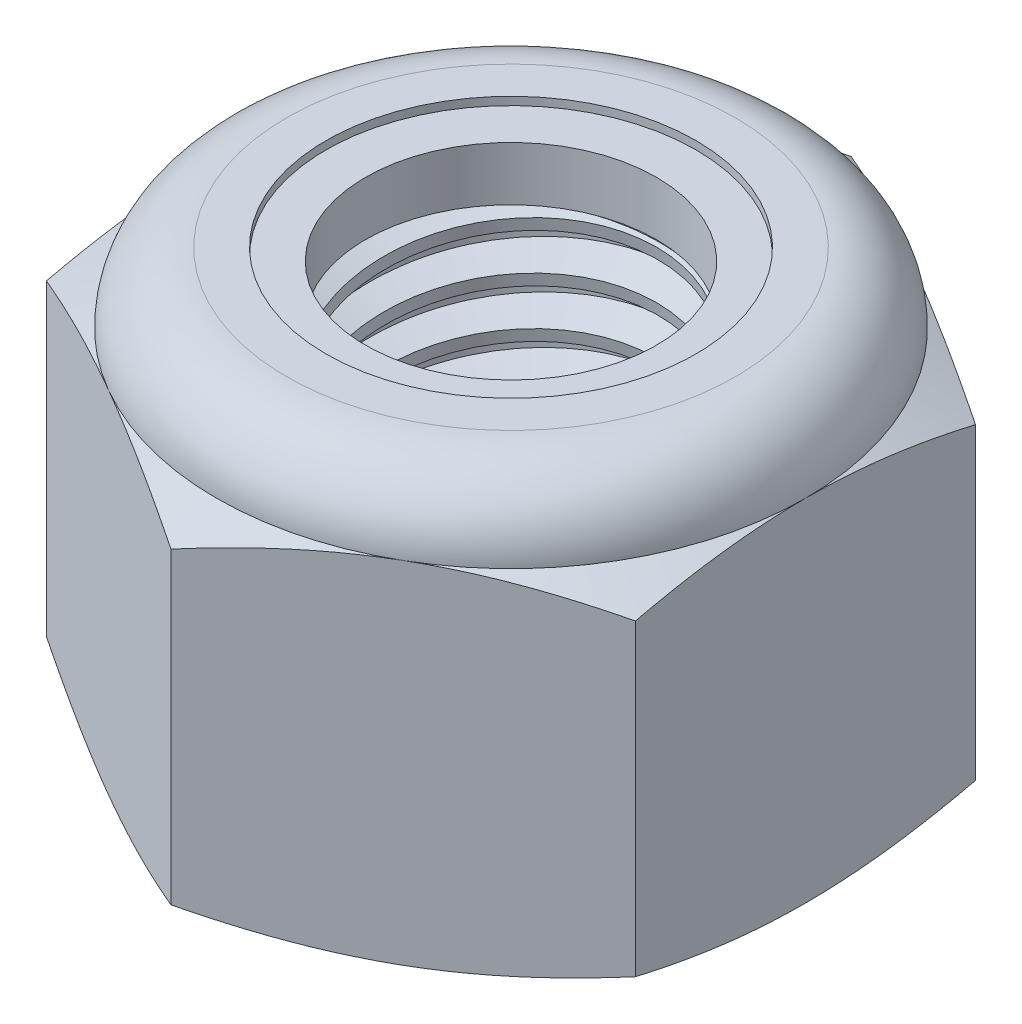
from build123d import *

# Parameters (mm, degrees)
EXTRUDE1_DEPTH      = 7.9375
SKETCH2_W           = 3.175
SKETCH2_H           = 7.9375
LPATTERN1_COUNT     = 9
LPATTERN1_PITCH     = 0.907142857
LPATTERN1_COL_COUNT = 2
LPATTERN1_COL_PITCH = 0.907142857


with BuildPart() as part:
    # Sketch1 → Extrude1 (new body)
    with BuildSketch(Plane(origin=(0, 0, 0), x_dir=(1, 0, 0), z_dir=(0, 1, 0))):
        Polygon((0, 6.415804866), (-5.55625, 3.207902433), (-5.55625, -3.207902433), (0, -6.415804866), (5.55625, -3.207902433), (5.55625, 3.207902433), align=None)
    extrude(amount=EXTRUDE1_DEPTH)

    # Sketch4 → Cut-Revolve2 (revolve, cut)
    with BuildSketch(Plane(origin=(0, 0, 0), x_dir=(0, 0, -1), z_dir=(1, 0, 0)), mode=Mode.PRIVATE) as cut_revolve2_sk:
        Polygon((0, 7.9375), (3.175, 7.9375), (2.74505598, 7.737013811), (2.74505598, 0.200486189), (3.175, 0), (0, 0), align=None)
    revolve(cut_revolve2_sk.sketch.rotate(Axis((0, 7.9375, 0), (0, 1, 0)), 54.939743186), axis=Axis((0, 7.9375, 0), (0, 1, 0)), mode=Mode.SUBTRACT)


with BuildPart() as body_2:
    # Sketch2 → Revolve1 (revolve)
    with BuildSketch(Plane(origin=(0, 0, 0), x_dir=(0, 0, -1), z_dir=(1, 0, 0))):
        with Locations((1.5875, 3.96875)):
            Rectangle(SKETCH2_W, SKETCH2_H)
    revolve(axis=Axis((0, -3.175, 0), (0, 1, 0)))

    # Sketch3 → Cut-Revolve1 (revolve, cut)
    with BuildSketch(Plane(origin=(0, 0, 0), x_dir=(0, 0, -1), z_dir=(1, 0, 0)), mode=Mode.PRIVATE) as cut_revolve1_sk:
        Polygon((3.191036172, 7.825246798), (3.303289373, 7.039474388), (2.777128323, 7.250668732), (2.74505598, 7.475175135), align=None)
    cut_revolve1 = revolve(cut_revolve1_sk.sketch.rotate(Axis((0, 7.9375, 0.1384314), (0, -0.9899494936611666, -0.14142135623730967)), 180), axis=Axis((0, 7.9375, 0.1384314), (0, -0.9899494936611666, -0.14142135623730967)), mode=Mode.SUBTRACT)

    # LPattern1: Cut-Revolve1 ×9
    with Locations(*[(0, -i * LPATTERN1_PITCH, 0) for i in range(1, LPATTERN1_COUNT)]):
        add(cut_revolve1, mode=Mode.SUBTRACT)

    # LPattern1 col: Cut-Revolve1 ×2
    with Locations(*[(0, i * LPATTERN1_COL_PITCH, 0) for i in range(1, LPATTERN1_COL_COUNT)]):
        add(cut_revolve1, mode=Mode.SUBTRACT)


with BuildPart() as part_1:
    add(part.part)

    # Combine1: cut body 2
    add(body_2.part, mode=Mode.SUBTRACT)

    # Sketch5 → Cut-Revolve3 (revolve, cut)
    with BuildSketch(Plane(origin=(0, 0, 0), x_dir=(0, 0, -1), z_dir=(1, 0, 0)), mode=Mode.PRIVATE) as cut_revolve3_sk:
        with BuildLine():
            Line((0, 0), (5.55625, 0))
            Line((5.55625, 0), (6.415804866, 0.400817017))
            Line((6.415804866, 0.400817017), (6.415804866, 6.213766317))
            Line((6.415804866, 6.213766317), (5.55625, 6.614583333))
            ThreePointArc((5.55625, 6.614583333), (5.168776679, 7.550026679), (4.233333333, 7.9375))
            Line((4.233333333, 7.9375), (4.233333333, 9.2075))
            Line((4.233333333, 9.2075), (7.685804866, 9.2075))
            Line((7.685804866, 9.2075), (7.685804866, -1.27))
            Line((7.685804866, -1.27), (0, -1.27))
            Line((0, -1.27), (0, 0))
        make_face()
    revolve(cut_revolve3_sk.sketch.rotate(Axis((0, 0, 0), (0, 1, 0)), 54.939743186), axis=Axis((0, 0, 0), (0, 1, 0)), mode=Mode.SUBTRACT)

    # Sketch6 → Cut-Revolve4 (revolve, cut)
    with BuildSketch(Plane(origin=(0, 0, 0), x_dir=(0, 0, -1), z_dir=(1, 0, 0)), mode=Mode.PRIVATE) as cut_revolve4_sk:
        with BuildLine():
            Line((0, 6.614583333), (5.40385, 6.614583333))
            ThreePointArc((5.40385, 6.614583333), (5.061013606, 7.442263606), (4.233333333, 7.7851))
            Line((4.233333333, 7.7851), (3.489194657, 7.7851))
            Line((3.489194657, 7.7851), (3.489194657, 9.2075))
            Line((3.489194657, 9.2075), (0, 9.2075))
            Line((0, 9.2075), (0, 6.614583333))
        make_face()
    revolve(cut_revolve4_sk.sketch.rotate(Axis((0, 9.2075, 0), (0, 1, 0)), 54.939743186), axis=Axis((0, 9.2075, 0), (0, 1, 0)), mode=Mode.SUBTRACT)


with BuildPart() as body_2_2:
    # Sketch7 → Revolve2 (revolve)
    with BuildSketch(Plane(origin=(0, 0, 0), x_dir=(0, 0, -1), z_dir=(1, 0, 0)), mode=Mode.PRIVATE) as revolve2_sk:
        with BuildLine():
            Line((2.74505598, 6.690783333), (5.324993778, 6.690783333))
            ThreePointArc((5.324993778, 6.690783333), (4.979705237, 7.4148695), (4.233333333, 7.7089))
            Line((4.233333333, 7.7089), (2.74505598, 7.7089))
            Line((2.74505598, 7.7089), (2.74505598, 6.690783333))
        make_face()
    revolve(revolve2_sk.sketch.rotate(Axis((0, 6.690783333, 0), (0, 1, 0)), 54.939743186), axis=Axis((0, 6.690783333, 0), (0, 1, 0)))


solid = Compound([part_1.part, body_2_2.part])
